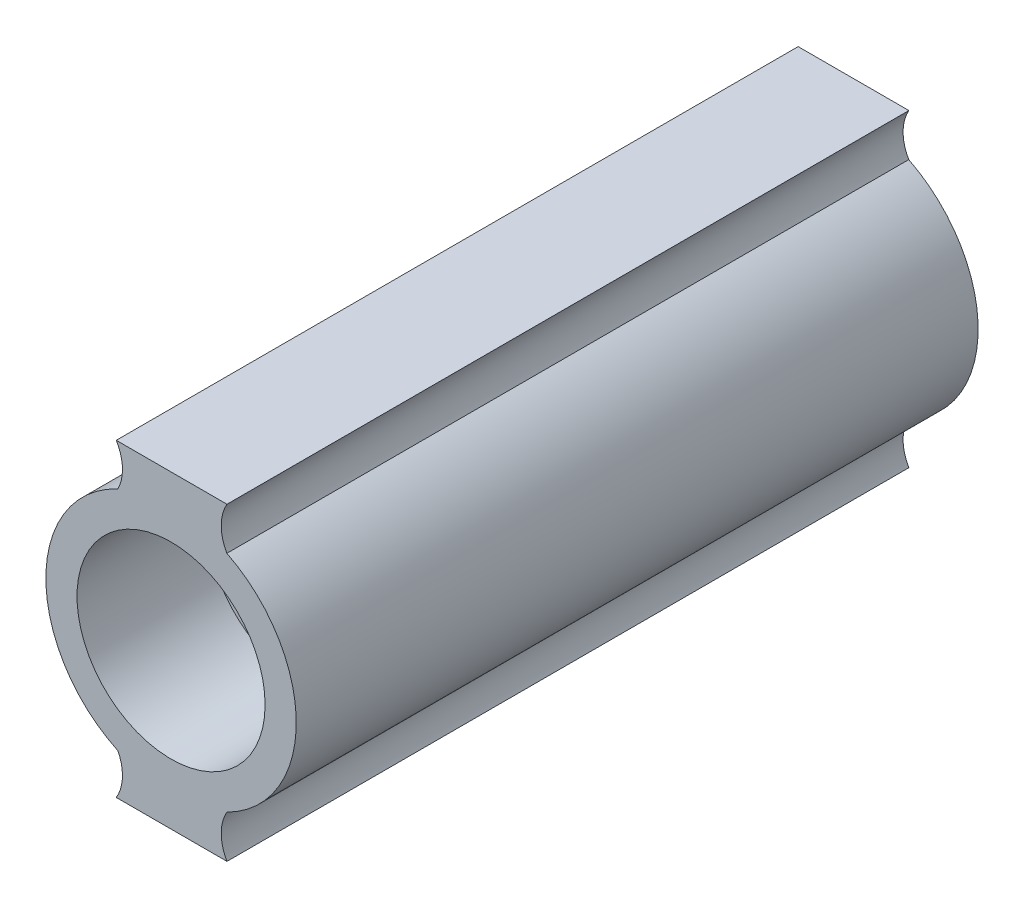
from build123d import *
from build123d.topology import SkipClean

# Parameters (mm, degrees)
BOSS_EXTRUDE1_DEPTH   = 0.00254
BOSS_EXTRUDE1_2_DEPTH = 0.00254
BOSS_EXTRUDE1_3_DEPTH = 0.00254
BOSS_EXTRUDE1_4_DEPTH = 0.00254
SKETCH1_3_R           = 4.7625
BOSS_EXTRUDE2_DEPTH   = 1.9812
SKETCH1_6_R           = 14.02334
BOSS_EXTRUDE4_DEPTH   = 1.9812
SKETCH1_7_R           = 18.669
SKETCH1_7_R_2         = 14.02334
BOSS_EXTRUDE5_DEPTH   = 21.4122
BOSS_EXTRUDE6_DEPTH   = 21.4122
BOSS_EXTRUDE7_DEPTH   = 80.264
SKETCH9_R             = 4.064
CUT_EXTRUDE6_DEPTH    = 11.938
SKETCH10_R            = 3.556
CUT_EXTRUDE7_DEPTH    = 25.4


with BuildPart() as part:
    # Sketch1 → Boss-Extrude1 (new body)
    with BuildSketch(Plane.XY):
        with BuildLine():
            add(Edge.make_bspline(
                [(-11.267882352, 10.780839024), (-10.870534927, 8.031966006), (-8.087704817, 8.031966006), (-5.304874707, 8.031966006), (-4.907527282, 10.780839024)],
                knots=[3.284867705, 3.284867705, 3.284867705, 4.71238898, 4.71238898, 6.139910255, 6.139910255, 6.139910255], degree=2, weights=[1, 0.755905209, 1, 0.755905209, 1]))
            add(Edge.make_bspline(
                [(-4.907527282, 10.780839024), (-4.377808345, 14.445466006), (-8.087704817, 14.445466006), (-11.79760129, 14.445466006), (-11.267882352, 10.780839024)],
                knots=[6.139910255, 6.139910255, 6.139910255, 7.853981634, 7.853981634, 9.568053013, 9.568053013, 9.568053013], degree=2, weights=[1, 0.654681079, 1, 0.654681079, 1]))
        make_face()
    extrude(amount=BOSS_EXTRUDE1_DEPTH)



with BuildPart() as body_2:
    # Sketch1 → Boss-Extrude1 2 (new body)
    with BuildSketch(Plane.XY):
        with BuildLine():
            add(Edge.make_bspline(
                [(-15.980077835, -0.291711529), (-13.231204817, 0.105635896), (-13.231204817, 2.888466006), (-13.231204817, 5.671296116), (-15.980077835, 6.068643541)],
                knots=[3.284867705, 3.284867705, 3.284867705, 4.71238898, 4.71238898, 6.139910255, 6.139910255, 6.139910255], degree=2, weights=[1, 0.755905209, 1, 0.755905209, 1]))
            add(Edge.make_bspline(
                [(-15.980077835, 6.068643541), (-19.644704817, 6.598362479), (-19.644704817, 2.888466006), (-19.644704817, -0.821430466), (-15.980077835, -0.291711529)],
                knots=[6.139910255, 6.139910255, 6.139910255, 7.853981634, 7.853981634, 9.568053013, 9.568053013, 9.568053013], degree=2, weights=[1, 0.654681079, 1, 0.654681079, 1]))
        make_face()
    extrude(amount=BOSS_EXTRUDE1_2_DEPTH)


with BuildPart() as body_3:
    # Sketch1 → Boss-Extrude1 3 (new body)
    with BuildSketch(Plane.XY):
        with BuildLine():
            add(Edge.make_bspline(
                [(-4.907527282, -5.003907011), (-5.304874707, -2.255033994), (-8.087704817, -2.255033994), (-10.870534927, -2.255033994), (-11.267882352, -5.003907011)],
                knots=[3.284867705, 3.284867705, 3.284867705, 4.71238898, 4.71238898, 6.139910255, 6.139910255, 6.139910255], degree=2, weights=[1, 0.755905209, 1, 0.755905209, 1]))
            add(Edge.make_bspline(
                [(-11.267882352, -5.003907011), (-11.79760129, -8.668533994), (-8.087704817, -8.668533994), (-4.377808345, -8.668533994), (-4.907527282, -5.003907011)],
                knots=[6.139910255, 6.139910255, 6.139910255, 7.853981634, 7.853981634, 9.568053013, 9.568053013, 9.568053013], degree=2, weights=[1, 0.654681079, 1, 0.654681079, 1]))
        make_face()
    extrude(amount=BOSS_EXTRUDE1_3_DEPTH)


with BuildPart() as body_4:
    # Sketch1 → Boss-Extrude1 4 (new body)
    with BuildSketch(Plane.XY):
        with BuildLine():
            add(Edge.make_bspline(
                [(-0.1953318, 6.068643541), (-2.944204817, 5.671296116), (-2.944204817, 2.888466006), (-2.944204817, 0.105635896), (-0.1953318, -0.291711529)],
                knots=[3.284867705, 3.284867705, 3.284867705, 4.71238898, 4.71238898, 6.139910255, 6.139910255, 6.139910255], degree=2, weights=[1, 0.755905209, 1, 0.755905209, 1]))
            add(Edge.make_bspline(
                [(-0.1953318, -0.291711529), (3.469295183, -0.821430466), (3.469295183, 2.888466006), (3.469295183, 6.598362479), (-0.1953318, 6.068643541)],
                knots=[6.139910255, 6.139910255, 6.139910255, 7.853981634, 7.853981634, 9.568053013, 9.568053013, 9.568053013], degree=2, weights=[1, 0.654681079, 1, 0.654681079, 1]))
        make_face()
    extrude(amount=BOSS_EXTRUDE1_4_DEPTH)


with BuildPart() as part_1:
    add(part.part)

    add(body_2.part)  # Boss-Extrude2 merges body 2

    add(body_3.part)  # Boss-Extrude2 merges body 3

    add(body_4.part)  # Boss-Extrude2 merges body 4
    # Sketch1<3> → Boss-Extrude2 (add)
    with BuildSketch(Plane.XY):
        with BuildLine():
            ThreePointArc((-0.1953318, 6.068643541), (-2.070933216, 8.905237607), (-4.907527282, 10.780839024))
            add(Edge.make_bspline(
                [(-11.267882352, 10.780839024), (-10.870534927, 8.031966006), (-8.087704817, 8.031966006), (-5.304874707, 8.031966006), (-4.907527282, 10.780839024)],
                knots=[3.284867705, 3.284867705, 3.284867705, 4.71238898, 4.71238898, 6.139910255, 6.139910255, 6.139910255], degree=2, weights=[1, 0.755905209, 1, 0.755905209, 1]))
            ThreePointArc((-11.267882352, 10.780839024), (-14.104476418, 8.905237607), (-15.980077835, 6.068643541))
            add(Edge.make_bspline(
                [(-15.980077835, -0.291711529), (-13.231204817, 0.105635896), (-13.231204817, 2.888466006), (-13.231204817, 5.671296116), (-15.980077835, 6.068643541)],
                knots=[3.284867705, 3.284867705, 3.284867705, 4.71238898, 4.71238898, 6.139910255, 6.139910255, 6.139910255], degree=2, weights=[1, 0.755905209, 1, 0.755905209, 1]))
            ThreePointArc((-15.980077835, -0.291711529), (-14.104476418, -3.128305595), (-11.267882352, -5.003907011))
            add(Edge.make_bspline(
                [(-4.907527282, -5.003907011), (-5.304874707, -2.255033994), (-8.087704817, -2.255033994), (-10.870534927, -2.255033994), (-11.267882352, -5.003907011)],
                knots=[3.284867705, 3.284867705, 3.284867705, 4.71238898, 4.71238898, 6.139910255, 6.139910255, 6.139910255], degree=2, weights=[1, 0.755905209, 1, 0.755905209, 1]))
            ThreePointArc((-4.907527282, -5.003907011), (-2.070933216, -3.128305595), (-0.1953318, -0.291711529))
            add(Edge.make_bspline(
                [(-0.1953318, 6.068643541), (-2.944204817, 5.671296116), (-2.944204817, 2.888466006), (-2.944204817, 0.105635896), (-0.1953318, -0.291711529)],
                knots=[3.284867705, 3.284867705, 3.284867705, 4.71238898, 4.71238898, 6.139910255, 6.139910255, 6.139910255], degree=2, weights=[1, 0.755905209, 1, 0.755905209, 1]))
        make_face()
        with Locations((-8.087704817, 2.888466006)):
            Circle(SKETCH1_3_R, mode=Mode.SUBTRACT)
    extrude(amount=BOSS_EXTRUDE2_DEPTH)

    # Sketch1<6> → Boss-Extrude4 (add)
    with BuildSketch(Plane.XY):
        with Locations((-8.087704817, 2.888466006)):
            Circle(SKETCH1_6_R)
        with BuildLine():
            add(Edge.make_bspline(
                [(-15.980077835, 6.068643541), (-19.644704817, 6.598362479), (-19.644704817, 2.888466006), (-19.644704817, -0.821430466), (-15.980077835, -0.291711529)],
                knots=[6.139910255, 6.139910255, 6.139910255, 7.853981634, 7.853981634, 9.568053013, 9.568053013, 9.568053013], degree=2, weights=[1, 0.654681079, 1, 0.654681079, 1]))
            ThreePointArc((-15.980077835, -0.291711529), (-14.104476418, -3.128305595), (-11.267882352, -5.003907011))
            add(Edge.make_bspline(
                [(-11.267882352, -5.003907011), (-11.79760129, -8.668533994), (-8.087704817, -8.668533994), (-4.377808345, -8.668533994), (-4.907527282, -5.003907011)],
                knots=[6.139910255, 6.139910255, 6.139910255, 7.853981634, 7.853981634, 9.568053013, 9.568053013, 9.568053013], degree=2, weights=[1, 0.654681079, 1, 0.654681079, 1]))
            ThreePointArc((-4.907527282, -5.003907011), (-2.070933216, -3.128305595), (-0.1953318, -0.291711529))
            add(Edge.make_bspline(
                [(-0.1953318, -0.291711529), (3.469295183, -0.821430466), (3.469295183, 2.888466006), (3.469295183, 6.598362479), (-0.1953318, 6.068643541)],
                knots=[6.139910255, 6.139910255, 6.139910255, 7.853981634, 7.853981634, 9.568053013, 9.568053013, 9.568053013], degree=2, weights=[1, 0.654681079, 1, 0.654681079, 1]))
            ThreePointArc((-0.1953318, 6.068643541), (-2.070933216, 8.905237607), (-4.907527282, 10.780839024))
            add(Edge.make_bspline(
                [(-4.907527282, 10.780839024), (-4.377808345, 14.445466006), (-8.087704817, 14.445466006), (-11.79760129, 14.445466006), (-11.267882352, 10.780839024)],
                knots=[6.139910255, 6.139910255, 6.139910255, 7.853981634, 7.853981634, 9.568053013, 9.568053013, 9.568053013], degree=2, weights=[1, 0.654681079, 1, 0.654681079, 1]))
            ThreePointArc((-11.267882352, 10.780839024), (-14.104476418, 8.905237607), (-15.980077835, 6.068643541))
        make_face(mode=Mode.SUBTRACT)
    extrude(amount=BOSS_EXTRUDE4_DEPTH)

    # Sketch1<7> → Boss-Extrude5 (add)
    with BuildSketch(Plane.XY):
        with Locations((-8.087704817, 2.888466006)):
            Circle(SKETCH1_7_R)
        with Locations((-8.087704817, 2.888466006)):
            Circle(SKETCH1_7_R_2, mode=Mode.SUBTRACT)
    extrude(amount=BOSS_EXTRUDE5_DEPTH)

    # Sketch2 → Boss-Extrude6 (add, through all)
    with BuildSketch(Plane.XY.offset(21.4122)):
        with BuildLine():
            ThreePointArc((-16.011919536, 19.792263866), (-7.867306443, 21.556164995), (0.233391542, 19.60046518))
            ThreePointArc((0.233391542, 19.60046518), (-0.607958843, 22.777981932), (0.25217674, 25.95046518))
            Line((0.25217674, 25.95046518), (-16.25782326, 25.95046518))
            ThreePointArc((-16.25782326, 25.95046518), (-15.337670431, 22.903197631), (-16.011919536, 19.792263866))
        make_face()
        with BuildLine():
            ThreePointArc((0.233391542, -13.823533167), (-7.867306443, -15.779232983), (-16.011919536, -14.015331854))
            ThreePointArc((-16.011919536, -14.015331854), (-15.337670431, -17.126265618), (-16.25782326, -20.173533167))
            Line((-16.25782326, -20.173533167), (0.25217674, -20.173533167))
            ThreePointArc((0.25217674, -20.173533167), (-0.607958843, -17.001049919), (0.233391542, -13.823533167))
        make_face()
    extrude(amount=-BOSS_EXTRUDE6_DEPTH)

    # Sketch3 → Boss-Extrude7 (add)
    with SkipClean():  # the faces are left unmerged after this step: merging them gives an invalid solid
        with BuildSketch(Plane(origin=(0, 0, 0), x_dir=(-1, 0, 0), z_dir=(0, 0, -1))):
            with BuildLine():
                ThreePointArc((16.011919536, 19.792263866), (15.337670431, 22.903197631), (16.25782326, 25.95046518))
                Line((16.25782326, 25.95046518), (-0.25217674, 25.95046518))
                ThreePointArc((-0.25217674, 25.95046518), (0.607958843, 22.777981932), (-0.233391542, 19.60046518))
                ThreePointArc((-0.233391542, 19.60046518), (-10.581295183, 2.888466006), (-0.233391542, -13.823533167))
                ThreePointArc((-0.233391542, -13.823533167), (0.607958843, -17.001049919), (-0.25217674, -20.173533167))
                Line((-0.25217674, -20.173533167), (16.25782326, -20.173533167))
                ThreePointArc((16.25782326, -20.173533167), (15.337670431, -17.126265618), (16.011919536, -14.015331854))
                ThreePointArc((16.011919536, -14.015331854), (26.756704817, 2.888466006), (16.011919536, 19.792263866))
            make_face()
        extrude(amount=BOSS_EXTRUDE7_DEPTH)

    # Sketch9 → Cut-Extrude6 (cut)
    with SkipClean():  # the faces are left unmerged after this step: merging them gives an invalid solid
        with BuildSketch(Plane.XY):
            with Locations((-8.087704817, 2.888466006)):
                Circle(SKETCH9_R)
        extrude(amount=-CUT_EXTRUDE6_DEPTH, mode=Mode.SUBTRACT)

    # Sketch10 → Cut-Extrude7 (cut)
    with SkipClean():  # the faces are left unmerged after this step: merging them gives an invalid solid
        with BuildSketch(Plane(origin=(0, 0, -80.264), x_dir=(-1, 0, 0), z_dir=(0, 0, -1))):
            with Locations((8.087704817, 2.888466006)):
                Circle(SKETCH10_R)
        extrude(amount=-CUT_EXTRUDE7_DEPTH, mode=Mode.SUBTRACT)


solid = part_1.part
